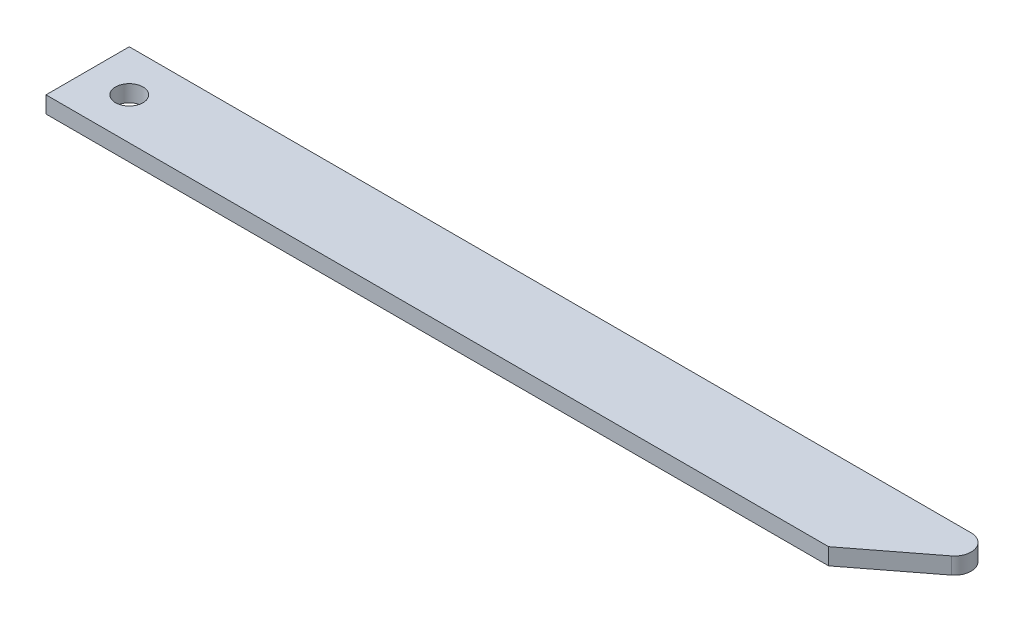
from build123d import *

# Parameters (mm, degrees)
BOSS_EXTRUDE1_DEPTH = 2.54
SKETCH4_R           = 2.0955
CUT_EXTRUDE2_DEPTH  = 121.080498


with BuildPart() as part:
    # Sketch1 → Boss-Extrude1 (new body)
    with BuildSketch(Plane(origin=(0, 0, 0), x_dir=(1, 0, 0), z_dir=(0, 1, 0))):
        with BuildLine():
            Line((0, 0), (-119.38, 0))
            Line((-119.38, 0), (-119.38, 12.7))
            Line((-119.38, 12.7), (9.042090255, 12.7))
            ThreePointArc((9.042090255, 12.7), (11.44680364, 10.977895798), (10.590755588, 8.146735068))
            Line((10.590755588, 8.146735068), (0, 0))
        make_face()
    extrude(amount=BOSS_EXTRUDE1_DEPTH)

    # Sketch4 → Cut-Extrude2 (cut, through all)
    with BuildSketch(Plane(origin=(0, 2.54, 0), x_dir=(1, 0, 0), z_dir=(0, 1, 0))):
        with Locations(Location((-113.03, 6.35, 0), (0, 0, 270))):
            Circle(SKETCH4_R)
    extrude(amount=-CUT_EXTRUDE2_DEPTH, mode=Mode.SUBTRACT)


solid = part.part
